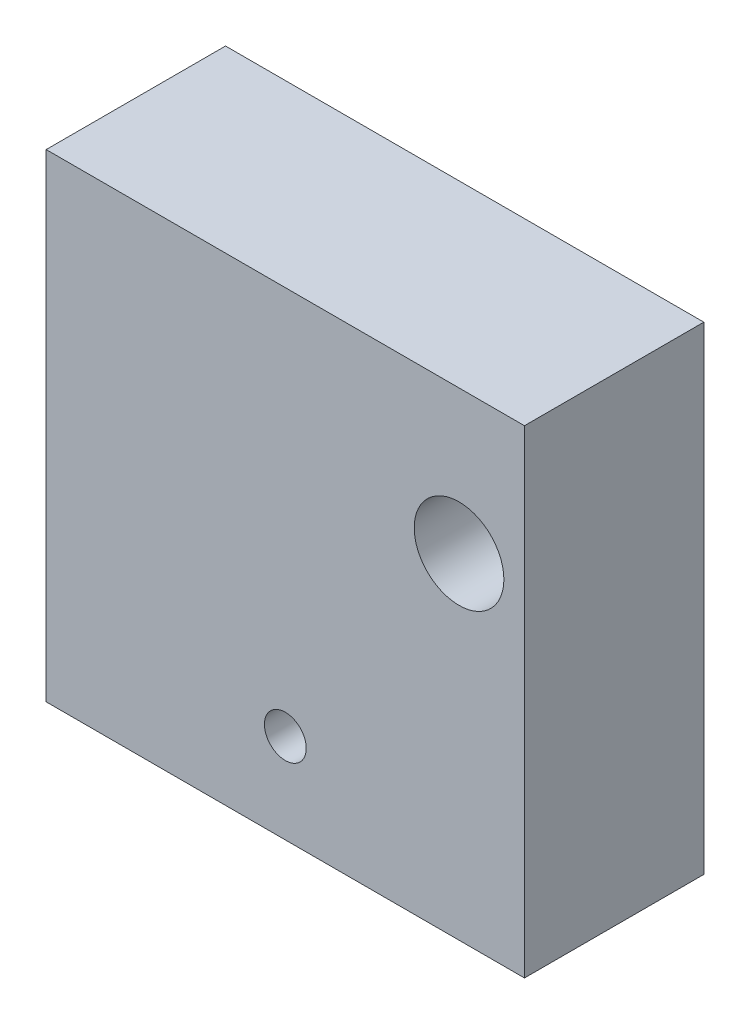
from build123d import *

# Parameters (mm, degrees)
SKETCH1_W           = 80
SKETCH1_H           = 80
BOSS_EXTRUDE1_DEPTH = 30
SKETCH3_W           = 40
SKETCH3_H           = 25
CUT_EXTRUDE2_DEPTH  = 20
SKETCH4_R           = 3.5
CUT_EXTRUDE3_DEPTH  = 61
SKETCH6_R           = 7.5
CUT_EXTRUDE5_DEPTH  = 65.031242374


with BuildPart() as part:
    # Sketch1 → Boss-Extrude1 (new body)
    with BuildSketch(Plane.XY):
        Rectangle(SKETCH1_W, SKETCH1_H)
    extrude(amount=BOSS_EXTRUDE1_DEPTH)

    # Sketch3 → Cut-Extrude2 (cut)
    with BuildSketch(Plane(origin=(0, 0, 0), x_dir=(-1, 0, 0), z_dir=(0, 0, -1))):
        with Locations((0, -27.5)):
            Rectangle(SKETCH3_W, SKETCH3_H)
    extrude(amount=-CUT_EXTRUDE2_DEPTH, mode=Mode.SUBTRACT)

    # Sketch4 → Cut-Extrude3 (cut, through all)
    with BuildSketch(Plane(origin=(0, 0, 20), x_dir=(-1, 0, 0), z_dir=(0, 0, -1))):
        with Locations((0, -25)):
            Circle(SKETCH4_R)
    extrude(amount=-CUT_EXTRUDE3_DEPTH, mode=Mode.SUBTRACT)

    # Sketch6 → Cut-Extrude5 (cut, through all)
    with BuildSketch(Plane.XY.offset(30)):
        with Locations((29.056312598, 16)):
            Circle(SKETCH6_R)
    extrude(amount=-CUT_EXTRUDE5_DEPTH, mode=Mode.SUBTRACT)


solid = part.part
